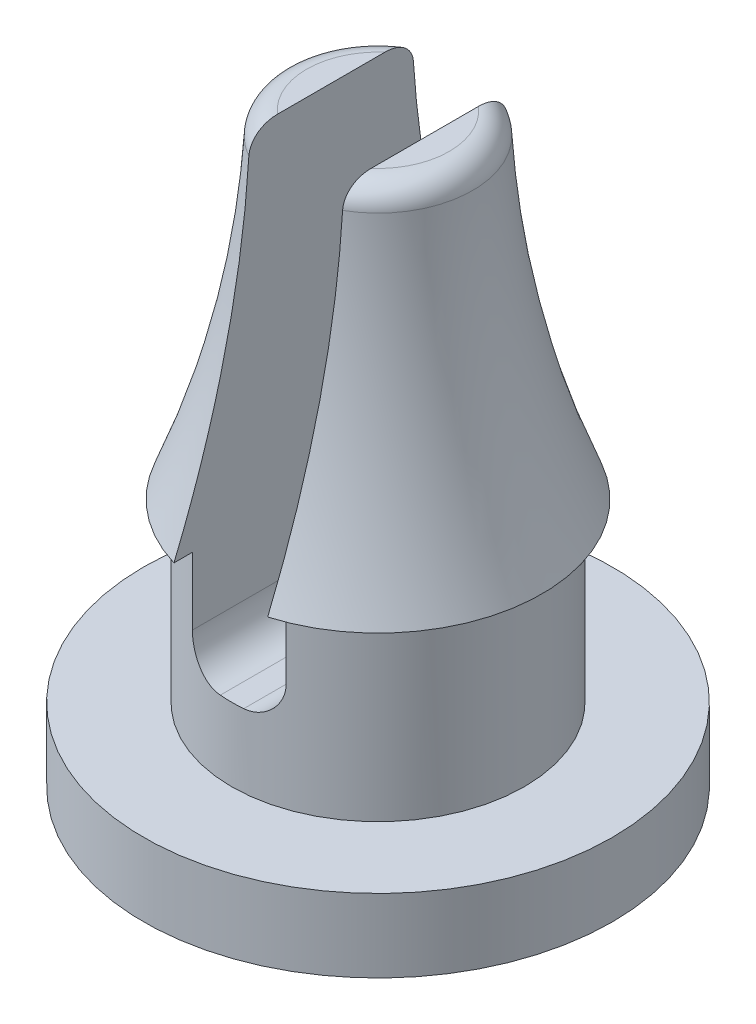
from build123d import *

# Parameters (mm, degrees)
CUT_EXTRUDE1_DEPTH      = 15.591189122
CUT_EXTRUDE1_DEPTH_BACK = 15.591189122


with BuildPart() as part:
    # Sketch1 → Revolve1 (revolve)
    with BuildSketch(Plane.XY):
        with BuildLine():
            Line((0, 0), (-5.08, 0))
            Line((-5.08, 0), (-5.08, 1.5875))
            Line((-5.08, 1.5875), (-3.175, 1.5875))
            Line((-3.175, 1.5875), (-3.175, 5.3975))
            Line((-3.175, 5.3975), (-3.556, 5.3975))
            ThreePointArc((-3.556, 5.3975), (-2.52664009, 8.747354796), (-2.052787845, 12.219612423))
            ThreePointArc((-2.052787845, 12.219612423), (-1.894850225, 12.560843538), (-1.545538839, 12.7))
            Line((-1.545538839, 12.7), (0, 12.7))
            Line((0, 12.7), (0, 0))
        make_face()
    revolve(axis=Axis((0, 12.7, 0), (0, -1, 0)))

    # Sketch2 → Cut-Extrude1 (cut, two sides: drawn at the far end of the back side and taken through both)
    with BuildSketch(Plane.XY.offset(-CUT_EXTRUDE1_DEPTH_BACK)):
        with BuildLine():
            Line((-0.254, 3.175), (0.254, 3.175))
            ThreePointArc((0.254, 3.175), (0.792815367, 3.398184633), (1.016, 3.937))
            Line((1.016, 3.937), (1.016, 12.7))
            Line((1.016, 12.7), (-1.016, 12.7))
            Line((-1.016, 12.7), (-1.016, 3.937))
            ThreePointArc((-1.016, 3.937), (-0.792815367, 3.398184633), (-0.254, 3.175))
        make_face()
    extrude(amount=CUT_EXTRUDE1_DEPTH + CUT_EXTRUDE1_DEPTH_BACK, mode=Mode.SUBTRACT)


solid = part.part
